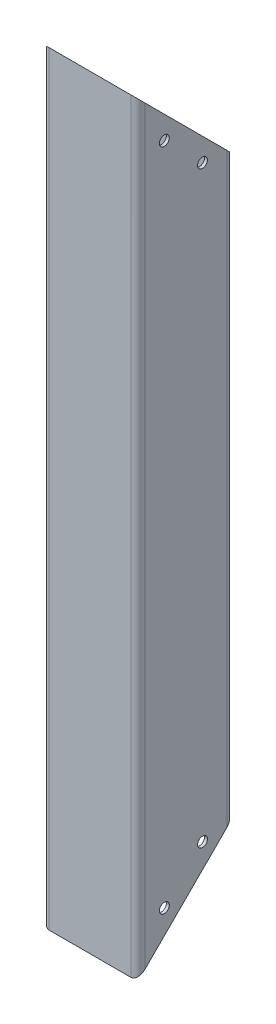
from build123d import *

# Parameters (mm, degrees)
STRUCTURAL_MEMBER1_DEPTH = 425
CUT_EXTRUDE1_DEPTH       = 430.163657012
M5_CLEARANCE_HOLE1_D     = 5.5


with BuildPart() as part:
    # Sketch16 → Structural Member1 (new body)
    with BuildSketch(Plane.ZX):
        with BuildLine():
            Line((-26.67, 22.70125), (-26.67, -22.70125))
            ThreePointArc((-26.67, -22.70125), (-25.507580038, -25.507580038), (-22.70125, -26.67))
            Line((-22.70125, -26.67), (22.70125, -26.67))
            ThreePointArc((22.70125, -26.67), (25.507580038, -25.507580038), (26.67, -22.70125))
            Line((26.67, -22.70125), (26.67, 22.70125))
            ThreePointArc((26.67, 22.70125), (25.507580038, 25.507580038), (22.70125, 26.67))
            Line((22.70125, 26.67), (-22.70125, 26.67))
            ThreePointArc((-22.70125, 26.67), (-25.507580038, 25.507580038), (-26.67, 22.70125))
        make_face()
        with BuildLine():
            Line((-25.019, 22.70125), (-25.019, -22.70125))
            ThreePointArc((-25.019, -22.70125), (-24.340146742, -24.340146742), (-22.70125, -25.019))
            Line((-22.70125, -25.019), (22.70125, -25.019))
            ThreePointArc((22.70125, -25.019), (24.340146742, -24.340146742), (25.019, -22.70125))
            Line((25.019, -22.70125), (25.019, 22.70125))
            ThreePointArc((25.019, 22.70125), (24.340146742, 24.340146742), (22.70125, 25.019))
            Line((22.70125, 25.019), (-22.70125, 25.019))
            ThreePointArc((-22.70125, 25.019), (-24.340146742, 24.340146742), (-25.019, 22.70125))
        make_face(mode=Mode.SUBTRACT)
    extrude(amount=STRUCTURAL_MEMBER1_DEPTH)

    # Sketch12 → Cut-Extrude1 (cut, through all)
    with BuildSketch(Plane(origin=(26.67, 0, 0), x_dir=(0, 0, -1), z_dir=(1, 0, 0))):
        Polygon((-26.67, 425), (26.67, 371.66), (26.67, 425), align=None)
        Polygon((26.67, 0), (-26.67, 0), (26.67, 53.34), align=None)
    extrude(amount=-CUT_EXTRUDE1_DEPTH, mode=Mode.SUBTRACT)

    # M5 Clearance Hole1 (through all)
    with Locations(Plane(origin=(26.67, 0, 0), x_dir=(0, 0, -1), z_dir=(1, 0, 0))):
        with Locations((-12.02081528, 397.622893219), (9.192388155, 376.409689783), (-12.02081528, 28.084213562), (9.192388155, 49.297416998)):
            Hole(M5_CLEARANCE_HOLE1_D / 2)


solid = part.part
